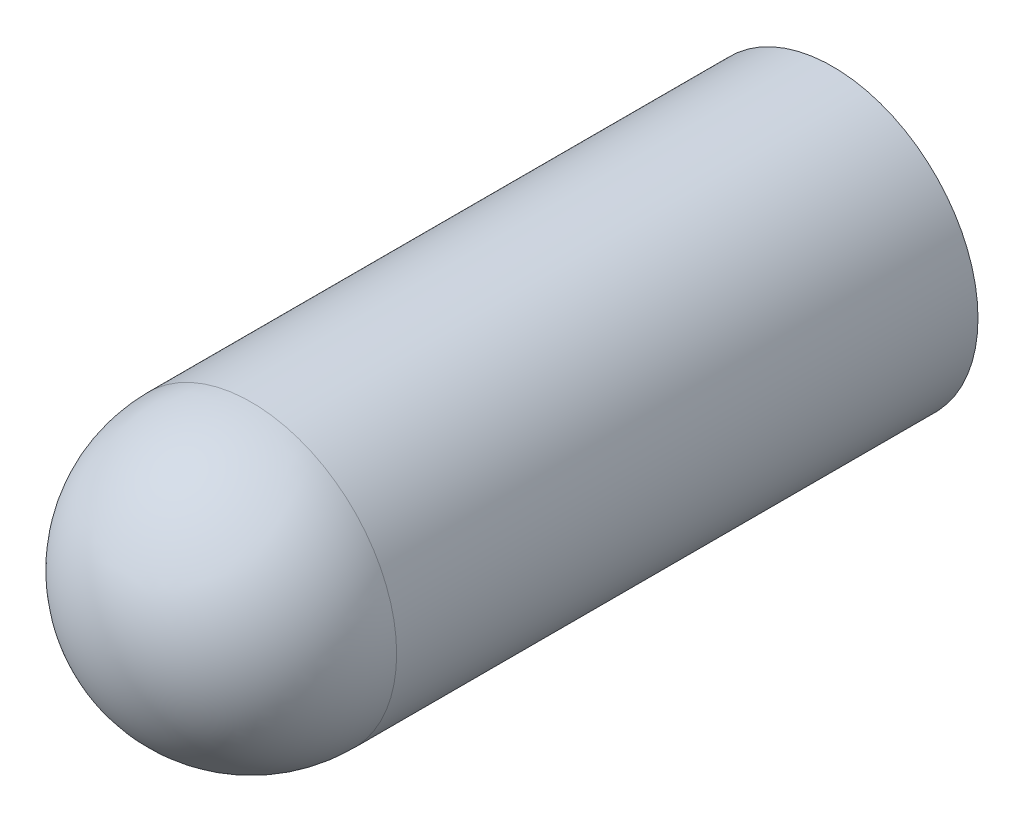
from build123d import *

# Parameters (mm, degrees)
SKETCH_1_R               = 12.5
EXTRUDE_1_DEPTH          = 62.5
FILLET_1_R               = 12.5
CUT_EXTRUDE_1_DEPTH      = 65.951905284
CUT_EXTRUDE_1_DEPTH_BACK = 45
SKETCH_2_R               = 10
SKETCH_3_R               = 10.5
CUT_EXTRUDE_2_DEPTH      = 5


with BuildPart() as part:
    # 草图1 → 凸台-拉伸1 (new body)
    with BuildSketch(Plane.XY):
        Circle(SKETCH_1_R)
    extrude(amount=EXTRUDE_1_DEPTH)

    # 圆角1
    fillet_1_edges = [part.edges().sort_by_distance(p)[0] for p in [
        (-12.5, 0, 62.5),
    ]]
    fillet(fillet_1_edges, radius=FILLET_1_R)

    # 草图2 → 切除-拉伸1 (cut, two sides: drawn at the far end of the back side and taken through both)
    with BuildSketch(Plane(origin=(0, 0, 0), x_dir=(-1, 0, 0), z_dir=(0, 0, -1)).offset(-CUT_EXTRUDE_1_DEPTH_BACK)):
        with Locations(Location((0, 0, 0), (0, 0, 180))):
            Circle(SKETCH_2_R)
    extrude(amount=CUT_EXTRUDE_1_DEPTH + CUT_EXTRUDE_1_DEPTH_BACK, mode=Mode.SUBTRACT)

    # 草图3 → 切除-拉伸2 (cut)
    with BuildSketch(Plane(origin=(0, 0, 45), x_dir=(-1, 0, 0), z_dir=(0, 0, -1))):
        Circle(SKETCH_3_R)
    extrude(amount=-CUT_EXTRUDE_2_DEPTH, mode=Mode.SUBTRACT)


solid = part.part
